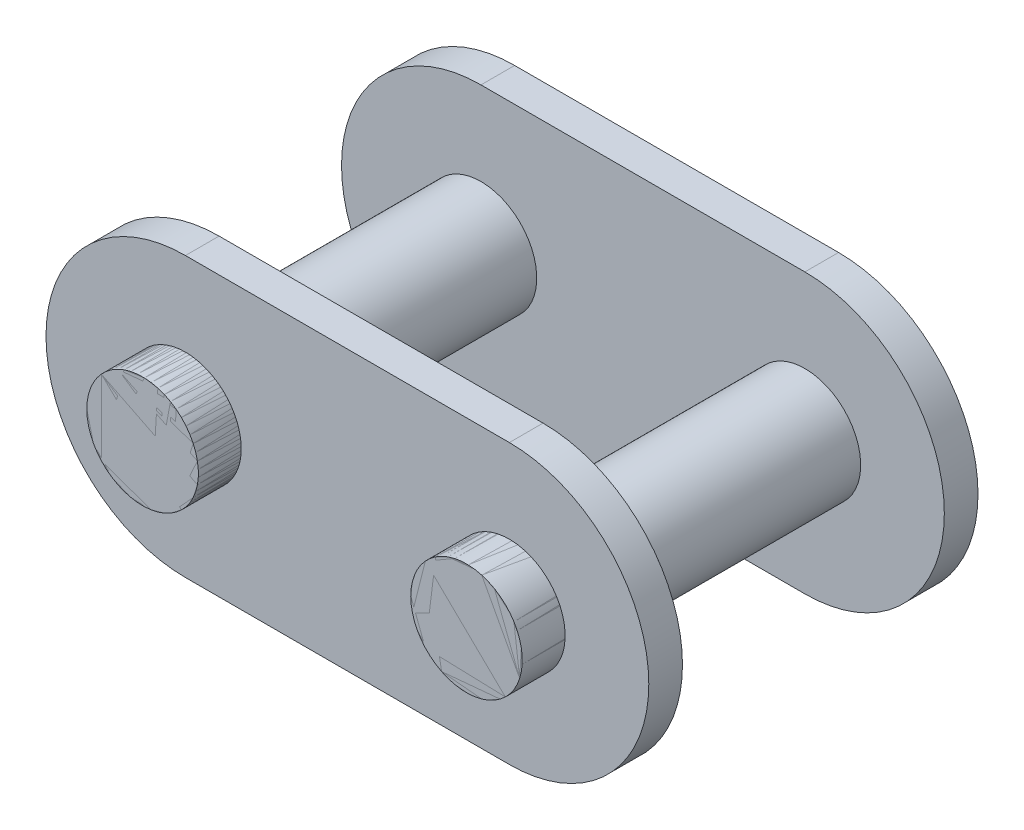
from build123d import *

# Parameters (mm, degrees)
SKETCH1_R                = 1.64
BOSS_EXTRUDE1_DEPTH      = 0.99
BOSS_EXTRUDE2_DEPTH      = 9.95
BOSS_EXTRUDE2_DEPTH_BACK = 2.25
SKETCH2_R                = 1.64


with BuildPart() as part:
    # Sketch1 → Boss-Extrude1 (new body)
    with BuildSketch(Plane.XY):
        with BuildLine():
            Line((0, 4.1), (9.525, 4.1))
            ThreePointArc((9.525, 4.1), (13.625, 0), (9.525, -4.1))
            Line((9.525, -4.1), (0, -4.1))
            ThreePointArc((0, -4.1), (-4.1, 0), (0, 4.1))
        make_face()
        Circle(SKETCH1_R, mode=Mode.SUBTRACT)
        with Locations(Location((9.525, 0, 0), (0, 0, 180))):
            Circle(SKETCH1_R, mode=Mode.SUBTRACT)
    extrude(amount=BOSS_EXTRUDE1_DEPTH)

    # Sketch2 → Boss-Extrude2 (add, two sides: drawn at the far end of the back side and taken through both)
    with BuildSketch(Plane(origin=(0, 0, 0), x_dir=(-1, 0, 0), z_dir=(0, 0, -1)).offset(-BOSS_EXTRUDE2_DEPTH_BACK)):
        with Locations((-9.525, 0)):
            Circle(SKETCH2_R)
        Circle(SKETCH2_R)
    extrude(amount=BOSS_EXTRUDE2_DEPTH + BOSS_EXTRUDE2_DEPTH_BACK)


with BuildPart() as body_2:
    # Mirror1: mirrored copy
    add(part.part.mirror(Plane(origin=(0, 0, -3.85), x_dir=(1, 0, 0), z_dir=(0, 0, -1))))


solid = Compound([part.part, body_2.part])
